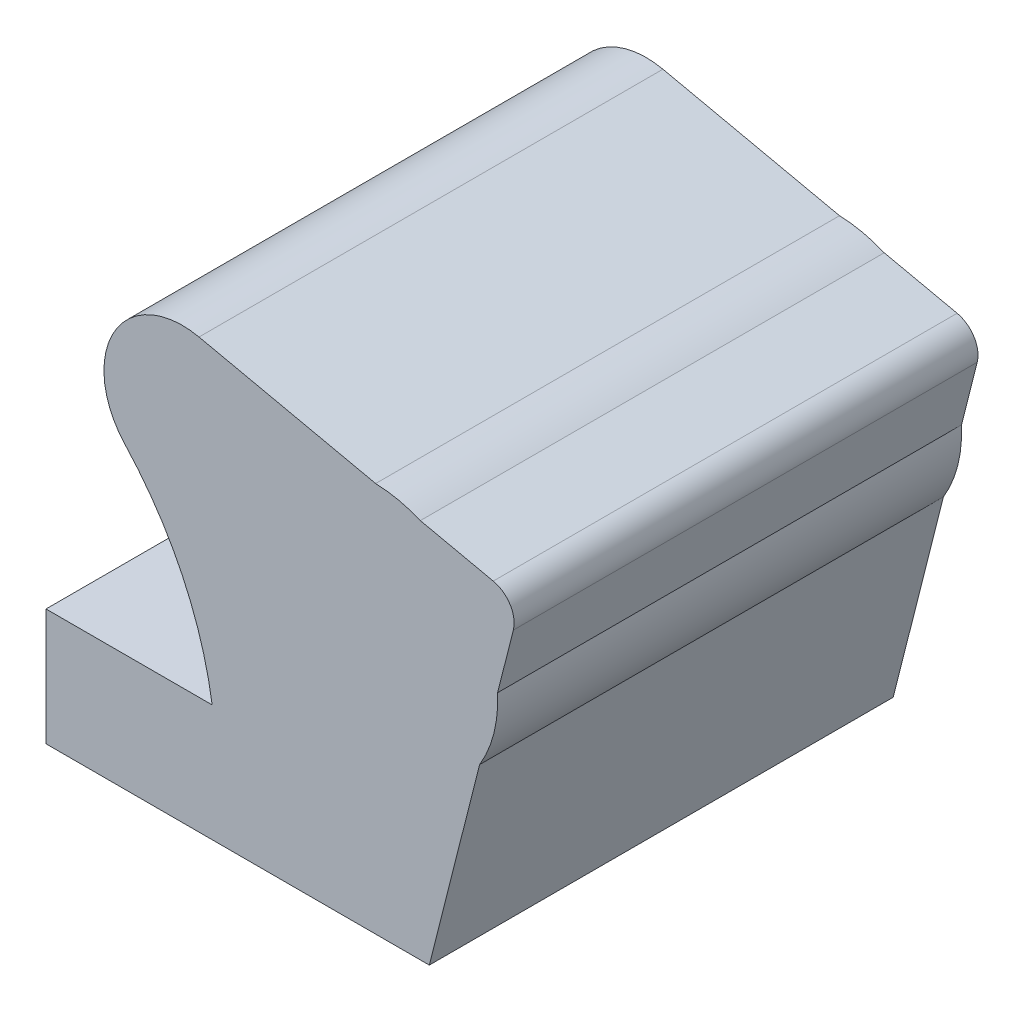
from build123d import *

# Parameters (mm, degrees)
EXTRUDE_1_DEPTH                = 50
SPLIT_BODIES_1_SURFACE_1_BACK  = 235.567
SPLIT_BODIES_1_SURFACE_1_DEPTH = 471.134
SPLIT_BODIES_1_SURFACE_2_BACK  = 235.567
SPLIT_BODIES_1_SURFACE_2_DEPTH = 471.134


with BuildPart() as part:
    # 草图1 → 凸台-拉伸1 (new, symmetric)
    with BuildSketch(Plane.XY):
        with BuildLine():
            Line((56.67204093, 43.504108875), (36.476006197, 29.147891414))
            Line((36.476006197, 29.147891414), (0, 29.147891414))
            Line((0, 29.147891414), (0, 0))
            Line((0, 0), (144.001, 0))
            Line((144.001, 0), (134.529857437, 27.122156161))
            Line((134.529857437, 27.122156161), (117.072161438, 27.122156161))
            Line((117.072161438, 27.122156161), (123.353516134, 49.257428232))
            Line((123.353516134, 49.257428232), (139.303205185, 49.257428232))
            Line((139.303205185, 49.257428232), (150.141177621, 92.108587215))
            ThreePointArc((150.141177621, 92.108587215), (153.228333696, 99.503580273), (154.028196985, 107.477078481))
            Line((154.028196985, 107.477078481), (157.411382406, 120.853511867))
            ThreePointArc((157.411382406, 120.853511867), (156.730372482, 125.265422842), (153.08647989, 127.844333418))
            Line((153.08647989, 127.844333418), (137.369721749, 131.276874543))
            ThreePointArc((137.369721749, 131.276874543), (132.648572458, 132.768940094), (127.735239934, 133.381046075))
            Line((127.735239934, 133.381046075), (89.661, 141.696462857))
            ThreePointArc((89.661, 141.696462857), (71.40391268, 133.595205289), (73.639067543, 113.746888123))
            ThreePointArc((73.639067543, 113.746888123), (86.014043833, 95.502710926), (92.496172884, 74.432066828))
            Line((92.496172884, 74.432066828), (56.67204093, 74.432066828))
            Line((56.67204093, 74.432066828), (56.67204093, 43.504108875))
        make_face()
    extrude(amount=EXTRUDE_1_DEPTH, both=True)


with BuildPart() as body_2:
    # Split Bodies 1: the piece behind the surface
    add(part.part)
    # Split Bodies 1 surface: a surface, the sketch's curves swept straight by 471.134 mm
    with BuildLine(Plane.XY.offset(50).offset(-SPLIT_BODIES_1_SURFACE_1_BACK), mode=Mode.PRIVATE) as split_bodies_1_surface_1_path:
        Line((123.353516134, 49.257428232), (56.67204093, 49.257428232))
    split_bodies_1_surface_1 = Shell.extrude(split_bodies_1_surface_1_path.wire(), (0 * SPLIT_BODIES_1_SURFACE_1_DEPTH, 0 * SPLIT_BODIES_1_SURFACE_1_DEPTH, 1 * SPLIT_BODIES_1_SURFACE_1_DEPTH))
    split(bisect_by=split_bodies_1_surface_1, keep=Keep.BOTTOM)


with BuildPart() as part_1:
    add(part.part)

    # Split Bodies 1: split by a surface, the side it looks to stays
    # Split Bodies 1 surface: a surface, the sketch's curves swept straight by 471.134 mm
    with BuildLine(Plane.XY.offset(50).offset(-SPLIT_BODIES_1_SURFACE_2_BACK), mode=Mode.PRIVATE) as split_bodies_1_surface_2_path:
        Line((123.353516134, 49.257428232), (56.67204093, 49.257428232))
    split_bodies_1_surface_2 = Shell.extrude(split_bodies_1_surface_2_path.wire(), (0 * SPLIT_BODIES_1_SURFACE_2_DEPTH, 0 * SPLIT_BODIES_1_SURFACE_2_DEPTH, 1 * SPLIT_BODIES_1_SURFACE_2_DEPTH))
    split(bisect_by=split_bodies_1_surface_2, keep=Keep.TOP)


solid = body_2.part
